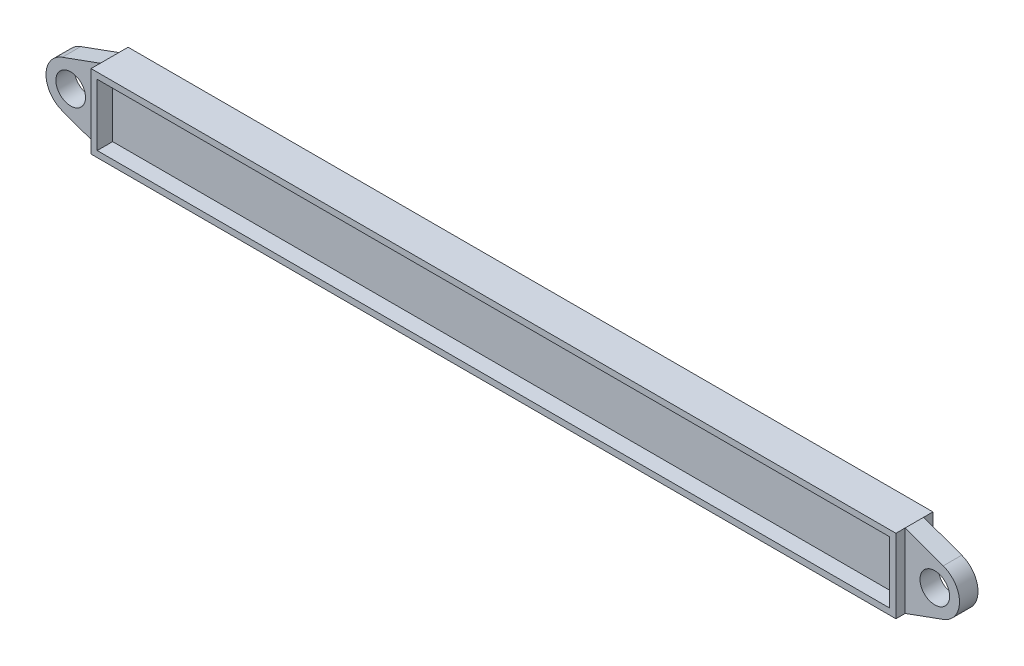
from build123d import *

# Parameters (mm, degrees)
SKETCH_1_R          = 12
EXTRUDE_1_DEPTH     = 30
CUT_EXTRUDE_START   = -7.5
SKETCH_2_R          = 12
CUT_EXTRUDE_1_DEPTH = 7.5
CUT_EXTRUDE_2_DEPTH = 7.5
SKETCH_4_W          = 642
SKETCH_4_H          = 50
CUT_EXTRUDE_3_DEPTH = 12.5
SKETCH_5_W          = 642
SKETCH_5_H          = 50
CUT_EXTRUDE_4_DEPTH = 12.5


with BuildPart() as part:
    # 草图1 → 凸台-拉伸1 (new body)
    with BuildSketch(Plane.XY):
        with BuildLine():
            Line((675.999999195, -9.999997784), (706.830258378, 1.202458393))
            ThreePointArc((706.830258378, 1.202458393), (720, 20), (706.830258378, 38.797541607))
            Line((706.830258378, 38.797541607), (675.999999195, 49.999997784))
            Line((675.999999195, 49.999997784), (24.000000805, 49.999997784))
            Line((24.000000805, 49.999997784), (-6.830258378, 38.797541607))
            ThreePointArc((-6.830258378, 38.797541607), (-20, 20), (-6.830258378, 1.202458393))
            Line((-6.830258378, 1.202458393), (24.000000805, -9.999997784))
            Line((24.000000805, -9.999997784), (675.999999195, -9.999997784))
        make_face()
        with Locations((0, 20)):
            Circle(SKETCH_1_R, mode=Mode.SUBTRACT)
        with Locations(Location((700, 20, 0), (0, 0, 180))):
            Circle(SKETCH_1_R, mode=Mode.SUBTRACT)
    extrude(amount=EXTRUDE_1_DEPTH)

    # 草图2 → 切除-拉伸1 (cut)
    # profile 1 of 2: a face of its own
    with BuildSketch(Plane.XY.offset(30).offset(CUT_EXTRUDE_START)):
        with BuildLine():
            Line((24.000000805, 49.999997784), (-6.830258378, 38.797541607))
            ThreePointArc((-6.830258378, 38.797541607), (-20, 20), (-6.830258378, 1.202458393))
            Line((-6.830258378, 1.202458393), (24.000000805, -9.999997784))
            Line((24.000000805, -9.999997784), (24.000000805, 49.999997784))
        make_face()
        with Locations((0, 20)):
            Circle(SKETCH_2_R, mode=Mode.SUBTRACT)
    # profile 2 of 2: a face of its own
    with BuildSketch(Plane.XY.offset(30).offset(CUT_EXTRUDE_START)):
        with BuildLine():
            Line((706.830258378, 38.797541607), (675.999999195, 49.999997784))
            Line((675.999999195, 49.999997784), (675.999999195, -9.999997784))
            Line((675.999999195, -9.999997784), (706.830258378, 1.202458393))
            ThreePointArc((706.830258378, 1.202458393), (720, 20), (706.830258378, 38.797541607))
        make_face()
    extrude(amount=CUT_EXTRUDE_1_DEPTH, mode=Mode.SUBTRACT)

    # 草图3 → 切除-拉伸2 (cut)
    with BuildSketch(Plane(origin=(0, 0, 0), x_dir=(-1, 0, 0), z_dir=(0, 0, -1))):
        with BuildLine():
            Line((6.830258378, 38.797541607), (-24.000000805, 49.999997784))
            Line((-24.000000805, 49.999997784), (-24.000000805, -9.999997784))
            Line((-24.000000805, -9.999997784), (6.830258378, 1.202458393))
            ThreePointArc((6.830258378, 1.202458393), (20, 20), (6.830258378, 38.797541607))
        make_face()
        with BuildLine():
            Line((-706.830258378, 38.797541607), (-675.999999195, 49.999997784))
            Line((-675.999999195, 49.999997784), (-675.999999195, -9.999997784))
            Line((-675.999999195, -9.999997784), (-706.830258378, 1.202458393))
            ThreePointArc((-706.830258378, 1.202458393), (-720, 20), (-706.830258378, 38.797541607))
        make_face()
    extrude(amount=-CUT_EXTRUDE_2_DEPTH, mode=Mode.SUBTRACT)

    # 草图4 → 切除-拉伸3 (cut)
    with BuildSketch(Plane(origin=(0, 0, 0), x_dir=(-1, 0, 0), z_dir=(0, 0, -1))):
        with Locations((-349.999999195, 20.000002216)):
            Rectangle(SKETCH_4_W, SKETCH_4_H)
    extrude(amount=-CUT_EXTRUDE_3_DEPTH, mode=Mode.SUBTRACT)

    # 草图5 → 切除-拉伸4 (cut)
    with BuildSketch(Plane.XY.offset(30)):
        with Locations((350.000000805, 19.999997784)):
            Rectangle(SKETCH_5_W, SKETCH_5_H)
    extrude(amount=-CUT_EXTRUDE_4_DEPTH, mode=Mode.SUBTRACT)


solid = part.part
